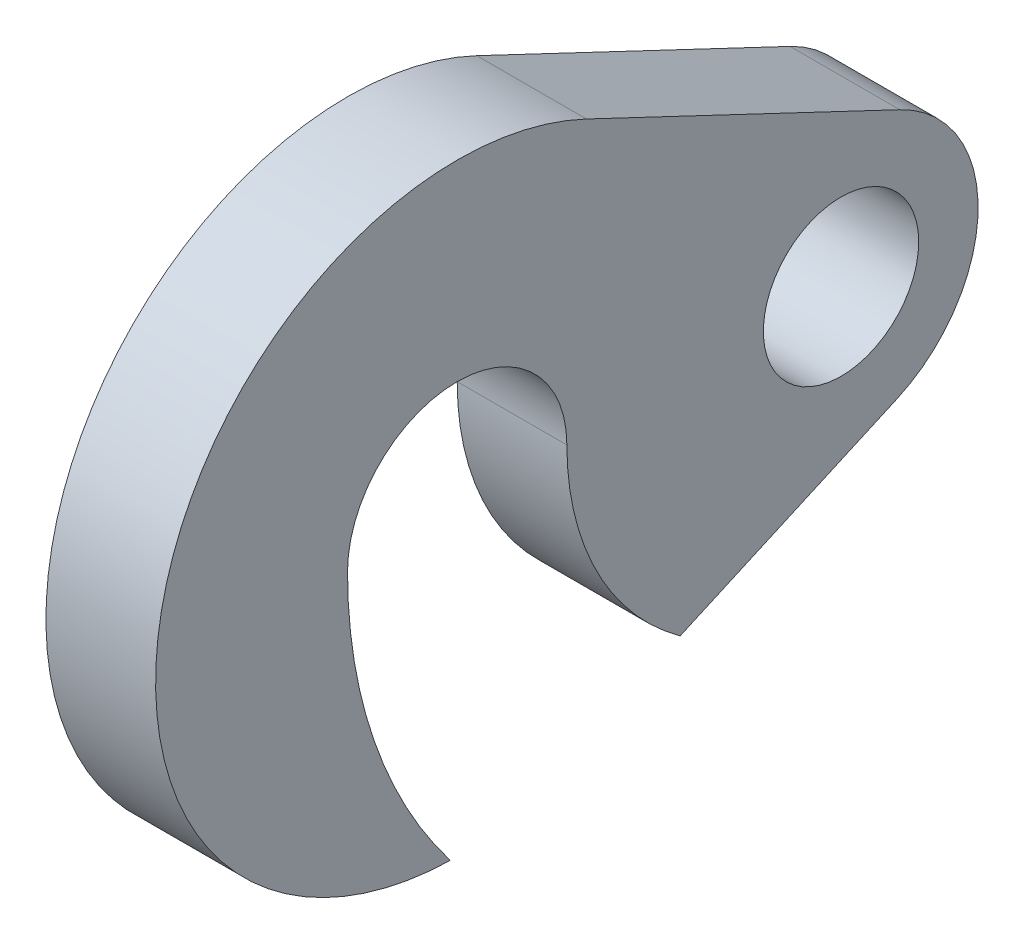
from build123d import *

# Parameters (mm, degrees)
SKETCH1_R           = 8.5
BOSS_EXTRUDE1_DEPTH = 12


with BuildPart() as part:
    # Sketch1 → Boss-Extrude1 (new body)
    with BuildSketch(Plane(origin=(0, 0, 0), x_dir=(0, 0, -1), z_dir=(1, 0, 0))):
        with BuildLine():
            Line((-17.601019721, -24.29411667), (6.119406169, -13.694994273))
            ThreePointArc((6.119406169, -13.694994273), (14.999034519, -0.170186666), (6.428571429, 13.552618544))
            Line((6.428571429, 13.552618544), (-27.857142857, 29.815760796))
            ThreePointArc((-27.857142857, 29.815760796), (-74.109646673, 7.613842033), (-42.75, -32.991476172))
            ThreePointArc((-42.75, -32.991476172), (-51.110175112, -17.428425058), (-54, 0))
            ThreePointArc((-54, 0), (-42, 12), (-30, 0))
            ThreePointArc((-30, 0), (-26.721064646, -13.637620914), (-17.601019721, -24.29411667))
        make_face()
        Circle(SKETCH1_R, mode=Mode.SUBTRACT)
    extrude(amount=BOSS_EXTRUDE1_DEPTH)


solid = part.part
